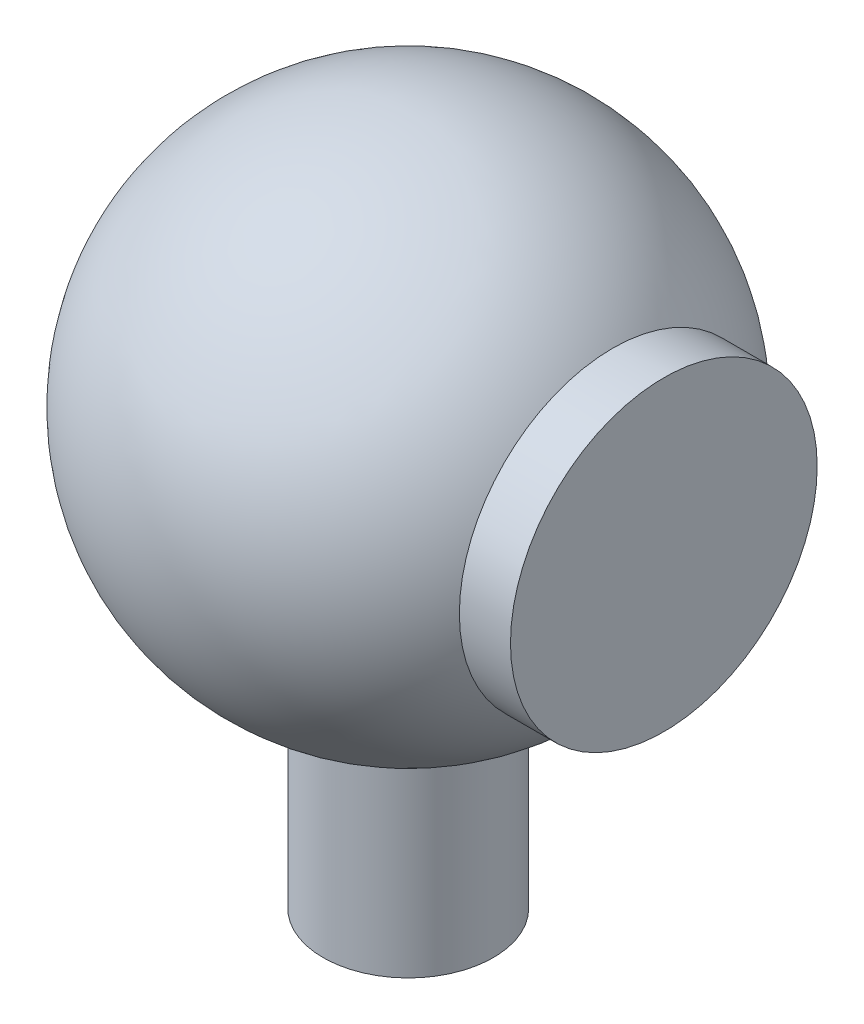
from build123d import *

# Parameters (mm, degrees)
SKETCH_2_W = 7.5
SKETCH_2_H = 17


with BuildPart() as part:
    # Эскиз1 → Повернуть5 (revolve)
    with BuildSketch(Plane.XY, mode=Mode.PRIVATE) as revolve_5_sk:
        with BuildLine():
            Line((22.5, -13.5), (22.5, 0))
            Line((22.5, 0), (-22.5, 0))
            ThreePointArc((-22.5, 0), (-7.115124735, -21.345374206), (18, -13.5))
            Line((18, -13.5), (22.5, -13.5))
        make_face()
    revolve(revolve_5_sk.sketch.rotate(Axis((0, 0, 0), (1, 0, 0)), 180), axis=Axis((0, 0, 0), (1, 0, 0)))

    # Эскиз2 → Повернуть6 (revolve)
    with BuildSketch(Plane.XY, mode=Mode.PRIVATE) as revolve_6_sk:
        with Locations((3.75, -29.713203436)):
            Rectangle(SKETCH_2_W, SKETCH_2_H)
    revolve(revolve_6_sk.sketch.rotate(Axis((0, -21.213203436, 0), (0, -1, 0)), 180), axis=Axis((0, -21.213203436, 0), (0, -1, 0)))


solid = part.part
